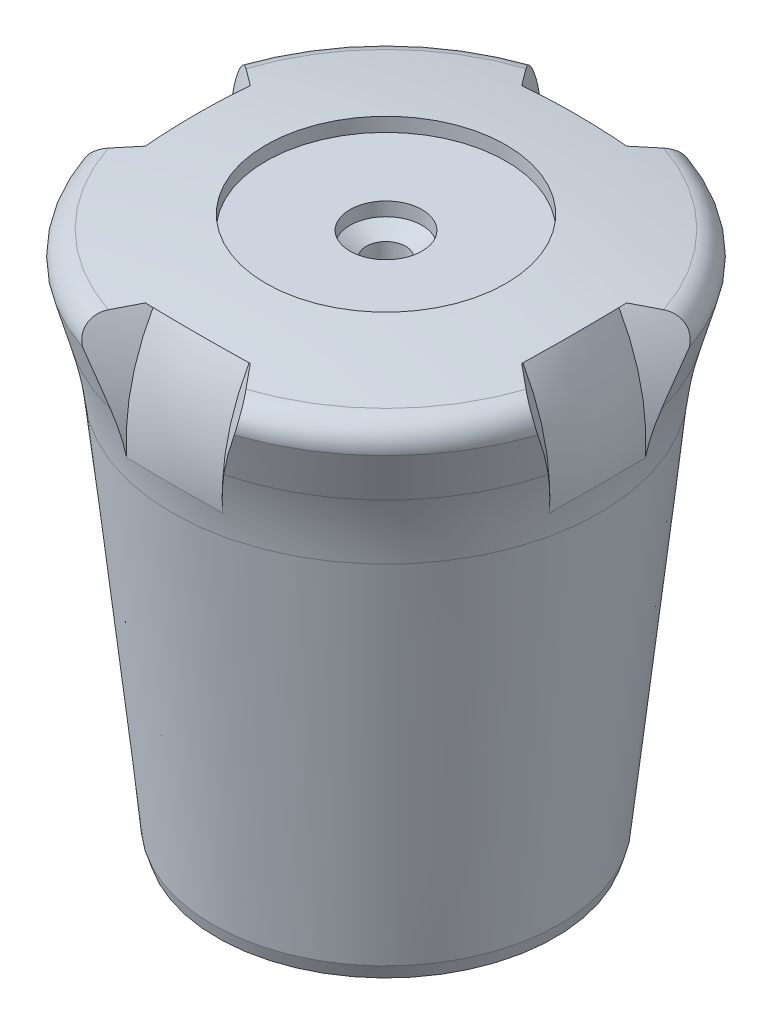
from build123d import *

# Parameters (mm, degrees)
SKETCH3_R          = 2.6035
CUT_EXTRUDE1_DEPTH = 66.347900423
FILLET1_R          = 50.8
CUT_EXTRUDE2_DEPTH = 9.652
CUT_REVOLVE4_ANGLE = 40
CIRPATTERN1_COUNT  = 4


with BuildPart() as part:
    # Sketch1 → Revolve1 (revolve)
    with BuildSketch(Plane.XY):
        with BuildLine():
            Line((31.706606027, 66.435973729), (22.918445219, 1.778))
            Line((22.918445219, 1.778), (22.352, 0))
            Line((22.352, 0), (20.066, 0))
            Line((20.066, 0), (20.066, 47.498))
            Line((20.066, 47.498), (0, 47.498))
            Line((0, 47.498), (0, 72.39))
            ThreePointArc((0, 72.39), (14.589103033, 71.790446028), (29.079815125, 69.995827589))
            ThreePointArc((29.079815125, 69.995827589), (31.115302374, 68.748727074), (31.706606027, 66.435973729))
        make_face()
    revolve(axis=Axis((0, 210.99638563, 0), (0, -1, 0)))

    # Sketch2 → Cut-Revolve1 (revolve, cut)
    with BuildSketch(Plane.XY):
        Polygon((-20.066, 37.133871375), (-20.066, 65.29941994), (-9.525, 65.29941994), (-9.525, 41.006634303), align=None)
    revolve(axis=Axis((0, 96.631544772, 0), (0, -1, 0)), mode=Mode.SUBTRACT)

    # Sketch3 → Cut-Extrude1 (cut, through all)
    with BuildSketch(Plane.XZ.offset(-47.498)):
        Circle(SKETCH3_R)
    extrude(amount=-CUT_EXTRUDE1_DEPTH, mode=Mode.SUBTRACT)

    # Sketch4 → Cut-Revolve2 (revolve, cut)
    with BuildSketch(Plane.XY):
        Polygon((31.706606027, 66.435973729), (28.702, 55.88), (22.918445219, 1.778), (37.804355577, 1.778), (47.82825173, 66.435973729), align=None)
    revolve(axis=Axis((0, 87.322464466, 0), (0, -1, 0)), mode=Mode.SUBTRACT)

    # Fillet1
    fillet1_edges = [part.edges().sort_by_distance(p)[0] for p in [
        (-28.702, 55.88, 0),
    ]]
    fillet(fillet1_edges, radius=FILLET1_R)

    # Sketch5 → Cut-Revolve3 (revolve, cut)
    with BuildSketch(Plane.XY):
        Polygon((0, 75.596238507), (15.875, 75.596238507), (15.875, 69.830937639), (4.7625, 69.830937639), (4.7625, 68.02683461), (2.6035, 66.712374279), (0, 66.712374279), align=None)
    revolve(axis=Axis((0, 78.88135388, 0), (0, -1, 0)), mode=Mode.SUBTRACT)

    # Sketch8 → Cut-Extrude2 (cut)
    with BuildSketch(Plane.XZ.offset(-47.498)):
        with BuildLine():
            Line((-3.4544, 3.61484725), (-3.4544, -3.61484725))
            ThreePointArc((-3.4544, -3.61484725), (0, -5), (3.4544, -3.61484725))
            Line((3.4544, -3.61484725), (3.4544, 3.61484725))
            ThreePointArc((3.4544, 3.61484725), (0, 5), (-3.4544, 3.61484725))
        make_face()
    extrude(amount=-CUT_EXTRUDE2_DEPTH, mode=Mode.SUBTRACT)

    # Sketch7 → Cut-Revolve4 (revolve, cut)
    with BuildSketch(Plane(origin=(24.305448763, 42.098272158, 0), x_dir=(0, 0, 1), z_dir=(-0.49999999999999495, -0.8660254037844416, 0))):
        with BuildLine():
            Line((-6.35, 56.220899932), (-15.806079823, 65.676979755))
            Line((-15.806079823, 65.676979755), (15.806079823, 65.676979755))
            Line((15.806079823, 65.676979755), (6.35, 56.220899932))
            ThreePointArc((6.35, 56.220899932), (0, 57.027455683), (-6.35, 56.220899932))
        make_face()
    cut_revolve4 = revolve(axis=Axis((-0.88502679, 56.642, 55.055655404), (0, 0, 1)), revolution_arc=CUT_REVOLVE4_ANGLE, mode=Mode.SUBTRACT)

    # CirPattern1: Cut-Revolve4 ×4 about axis
    cirpattern1_axis = Axis((0, 80.328072314, 0), (0, -1, 0))
    for i in range(1, CIRPATTERN1_COUNT):
        add(cut_revolve4.rotate(cirpattern1_axis, i * 360 / CIRPATTERN1_COUNT), mode=Mode.SUBTRACT)


solid = part.part
